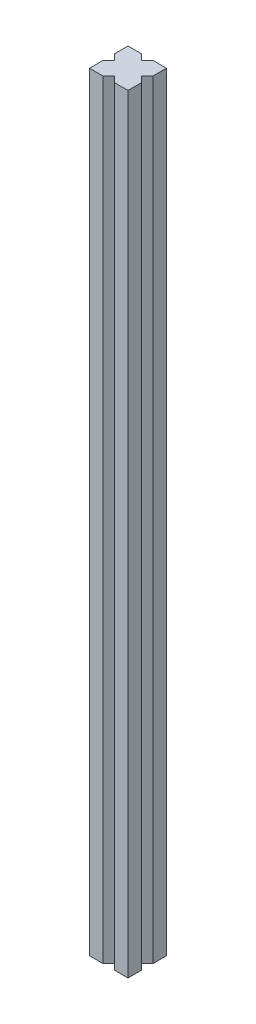
from build123d import *

# Parameters (mm, degrees)
SKIZZE1_W                       = 20
SKIZZE1_H                       = 20
AUFSATZ_LINEAR_AUSTRAGEN1_DEPTH = 400
SCHNITT_LINEAR_AUSTRAGEN1_DEPTH = 401.998753115


with BuildPart() as part:
    # Skizze1 → Aufsatz-Linear austragen1 (new body)
    with BuildSketch(Plane(origin=(0, 0, 0), x_dir=(1, 0, 0), z_dir=(0, 1, 0))):
        with Locations((10, 10)):
            Rectangle(SKIZZE1_W, SKIZZE1_H)
    extrude(amount=AUFSATZ_LINEAR_AUSTRAGEN1_DEPTH)

    # Skizze2 → Schnitt-Linear austragen1 (cut, through all)
    with BuildSketch(Plane(origin=(0, 400, 0), x_dir=(1, 0, 0), z_dir=(0, 1, 0))):
        Polygon((7, 20), (10, 17), (13, 20), align=None)
        Polygon((20, 13), (17, 10), (20, 7), align=None)
        Polygon((0, 7), (0, 13), (3, 10), align=None)
        Polygon((7, 0), (13, 0), (10, 3), align=None)
    extrude(amount=-SCHNITT_LINEAR_AUSTRAGEN1_DEPTH, mode=Mode.SUBTRACT)


solid = part.part
